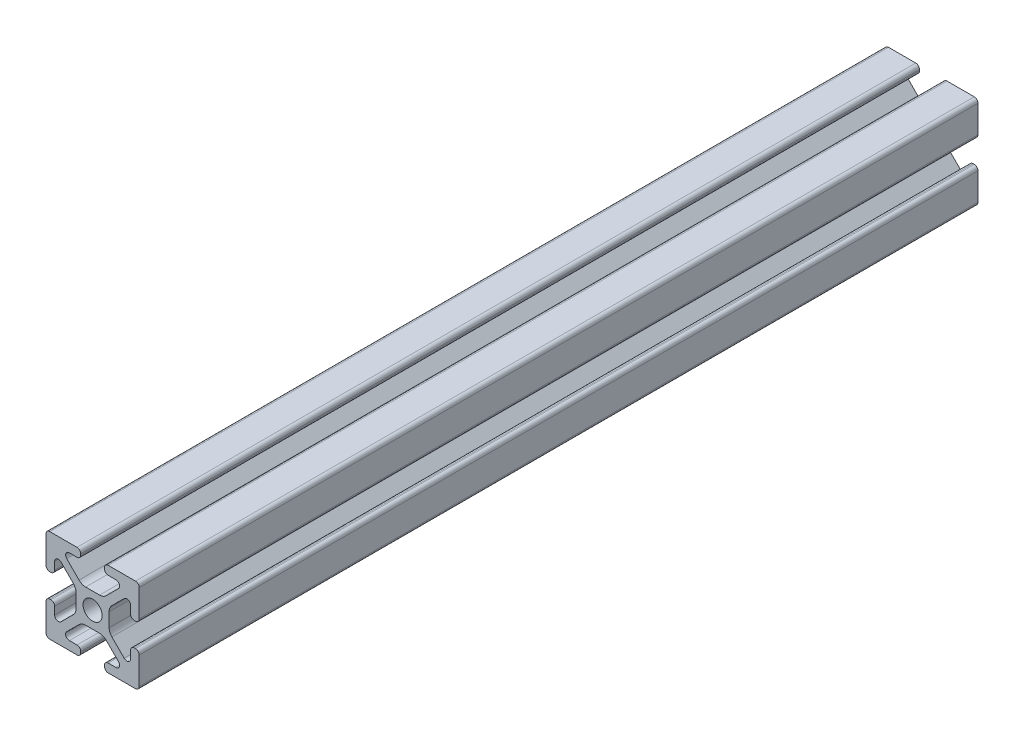
from build123d import *

# Parameters (mm, degrees)
BOSS_EXTRUDE1_DEPTH = 228.6
FILLET1_R           = 2.54
FILLET2_R           = 1.016
FILLET3_R           = 1.016


with BuildPart() as part:
    # Sketch1 → Boss-Extrude1 (new body)
    with BuildSketch(Plane.XY):
        Polygon((1.562564565, 25.4), (3.912064565, 23.0505), (9.4615, 23.0505), (9.4615, 25.4), align=None)
        with BuildLine():
            Line((11.814337736, 15.148226829), (9.754064565, 17.2085))
            Line((9.754064565, 17.2085), (3.912064565, 23.0505))
            Line((3.912064565, 23.0505), (1.562564565, 25.4))
            Line((1.562564565, 25.4), (0, 25.4))
            Line((0, 25.4), (0, 23.837435435))
            Line((0, 23.837435435), (2.3495, 21.487935435))
            Line((2.3495, 21.487935435), (8.1915, 15.645935435))
            Line((8.1915, 15.645935435), (10.251773171, 13.585662264))
            ThreePointArc((10.251773171, 13.585662264), (10.859047495, 14.540952505), (11.814337736, 15.148226829))
        make_face()
        Polygon((2.3495, 15.9385), (2.3495, 21.487935435), (0, 23.837435435), (0, 15.9385), align=None)
        with BuildLine():
            Line((13.585662264, 15.148226829), (15.645935435, 17.2085))
            Line((15.645935435, 17.2085), (9.754064565, 17.2085))
            Line((9.754064565, 17.2085), (11.814337736, 15.148226829))
            ThreePointArc((11.814337736, 15.148226829), (12.7, 15.3035), (13.585662264, 15.148226829))
        make_face()
        with BuildLine():
            ThreePointArc((10.251773171, 11.814337736), (10.0965, 12.7), (10.251773171, 13.585662264))
            Line((10.251773171, 13.585662264), (8.1915, 15.645935435))
            Line((8.1915, 15.645935435), (8.1915, 9.754064565))
            Line((8.1915, 9.754064565), (10.251773171, 11.814337736))
        make_face()
        with BuildLine():
            ThreePointArc((11.814337736, 10.251773171), (10.859047495, 10.859047495), (10.251773171, 11.814337736))
            Line((10.251773171, 11.814337736), (8.1915, 9.754064565))
            Line((8.1915, 9.754064565), (2.3495, 3.912064565))
            Line((2.3495, 3.912064565), (0, 1.562564565))
            Line((0, 1.562564565), (0, 0))
            Line((0, 0), (1.562564565, 0))
            Line((1.562564565, 0), (3.912064565, 2.3495))
            Line((3.912064565, 2.3495), (9.754064565, 8.1915))
            Line((9.754064565, 8.1915), (11.814337736, 10.251773171))
        make_face()
        with BuildLine():
            ThreePointArc((13.585662264, 10.251773171), (12.7, 10.0965), (11.814337736, 10.251773171))
            Line((11.814337736, 10.251773171), (9.754064565, 8.1915))
            Line((9.754064565, 8.1915), (15.645935435, 8.1915))
            Line((15.645935435, 8.1915), (13.585662264, 10.251773171))
        make_face()
        with BuildLine():
            Line((17.2085, 9.754064565), (15.148226829, 11.814337736))
            ThreePointArc((15.148226829, 11.814337736), (14.540952505, 10.859047495), (13.585662264, 10.251773171))
            Line((13.585662264, 10.251773171), (15.645935435, 8.1915))
            Line((15.645935435, 8.1915), (21.487935435, 2.3495))
            Line((21.487935435, 2.3495), (23.837435435, 0))
            Line((23.837435435, 0), (25.4, 0))
            Line((25.4, 0), (25.4, 1.562564565))
            Line((25.4, 1.562564565), (23.0505, 3.912064565))
            Line((23.0505, 3.912064565), (17.2085, 9.754064565))
        make_face()
        with BuildLine():
            Line((17.2085, 15.645935435), (15.148226829, 13.585662264))
            ThreePointArc((15.148226829, 13.585662264), (15.264387919, 13.149585199), (15.3035, 12.7))
            ThreePointArc((15.3035, 12.7), (15.264387919, 12.250414801), (15.148226829, 11.814337736))
            Line((15.148226829, 11.814337736), (17.2085, 9.754064565))
            Line((17.2085, 9.754064565), (17.2085, 15.645935435))
        make_face()
        with BuildLine():
            Line((23.837435435, 25.4), (21.487935435, 23.0505))
            Line((21.487935435, 23.0505), (15.645935435, 17.2085))
            Line((15.645935435, 17.2085), (13.585662264, 15.148226829))
            ThreePointArc((13.585662264, 15.148226829), (14.540952505, 14.540952505), (15.148226829, 13.585662264))
            Line((15.148226829, 13.585662264), (17.2085, 15.645935435))
            Line((17.2085, 15.645935435), (23.0505, 21.487935435))
            Line((23.0505, 21.487935435), (25.4, 23.837435435))
            Line((25.4, 23.837435435), (25.4, 25.4))
            Line((25.4, 25.4), (23.837435435, 25.4))
        make_face()
        Polygon((15.9385, 23.0505), (21.487935435, 23.0505), (23.837435435, 25.4), (15.9385, 25.4), align=None)
        Polygon((25.4, 15.9385), (25.4, 23.837435435), (23.0505, 21.487935435), (23.0505, 15.9385), align=None)
        Polygon((23.0505, 9.4615), (23.0505, 3.912064565), (25.4, 1.562564565), (25.4, 9.4615), align=None)
        Polygon((23.837435435, 0), (21.487935435, 2.3495), (15.9385, 2.3495), (15.9385, 0), align=None)
        Polygon((9.4615, 2.3495), (3.912064565, 2.3495), (1.562564565, 0), (9.4615, 0), align=None)
        Polygon((0, 1.562564565), (2.3495, 3.912064565), (2.3495, 9.4615), (0, 9.4615), align=None)
    extrude(amount=BOSS_EXTRUDE1_DEPTH)

    # Fillet1
    fillet1_edges = [part.edges().sort_by_distance(p)[0] for p in [
        (15.645935435, 8.1915, 114.3),
        (9.754064565, 8.1915, 114.3),
        (8.1915, 9.754064565, 114.3),
        (8.1915, 15.645935435, 114.3),
        (9.754064565, 17.2085, 114.3),
        (15.645935435, 17.2085, 114.3),
        (17.2085, 15.645935435, 114.3),
        (17.2085, 9.754064565, 114.3),
    ]]
    fillet(fillet1_edges, radius=FILLET1_R)

    # Fillet2
    fillet2_edges = [part.edges().sort_by_distance(p)[0] for p in [
        (23.0505, 9.4615, 114.3),
        (25.4, 9.4615, 114.3),
        (25.4, 0, 114.3),
        (15.9385, 0, 114.3),
        (15.9385, 2.3495, 114.3),
        (9.4615, 2.3495, 114.3),
        (9.4615, 0, 114.3),
        (0, 0, 114.3),
        (0, 9.4615, 114.3),
        (2.3495, 9.4615, 114.3),
        (2.3495, 15.9385, 114.3),
        (0, 15.9385, 114.3),
        (0, 25.4, 114.3),
        (9.4615, 25.4, 114.3),
        (9.4615, 23.0505, 114.3),
        (15.9385, 23.0505, 114.3),
        (15.9385, 25.4, 114.3),
        (25.4, 25.4, 114.3),
        (25.4, 15.9385, 114.3),
        (23.0505, 15.9385, 114.3),
    ]]
    fillet(fillet2_edges, radius=FILLET2_R)

    # Fillet3
    fillet3_edges = [part.edges().sort_by_distance(p)[0] for p in [
        (23.0505, 3.912064565, 114.3),
        (21.487935435, 2.3495, 114.3),
        (3.912064565, 2.3495, 114.3),
        (2.3495, 3.912064565, 114.3),
        (2.3495, 21.487935435, 114.3),
        (3.912064565, 23.0505, 114.3),
        (21.487935435, 23.0505, 114.3),
        (23.0505, 21.487935435, 114.3),
    ]]
    fillet(fillet3_edges, radius=FILLET3_R)


solid = part.part
